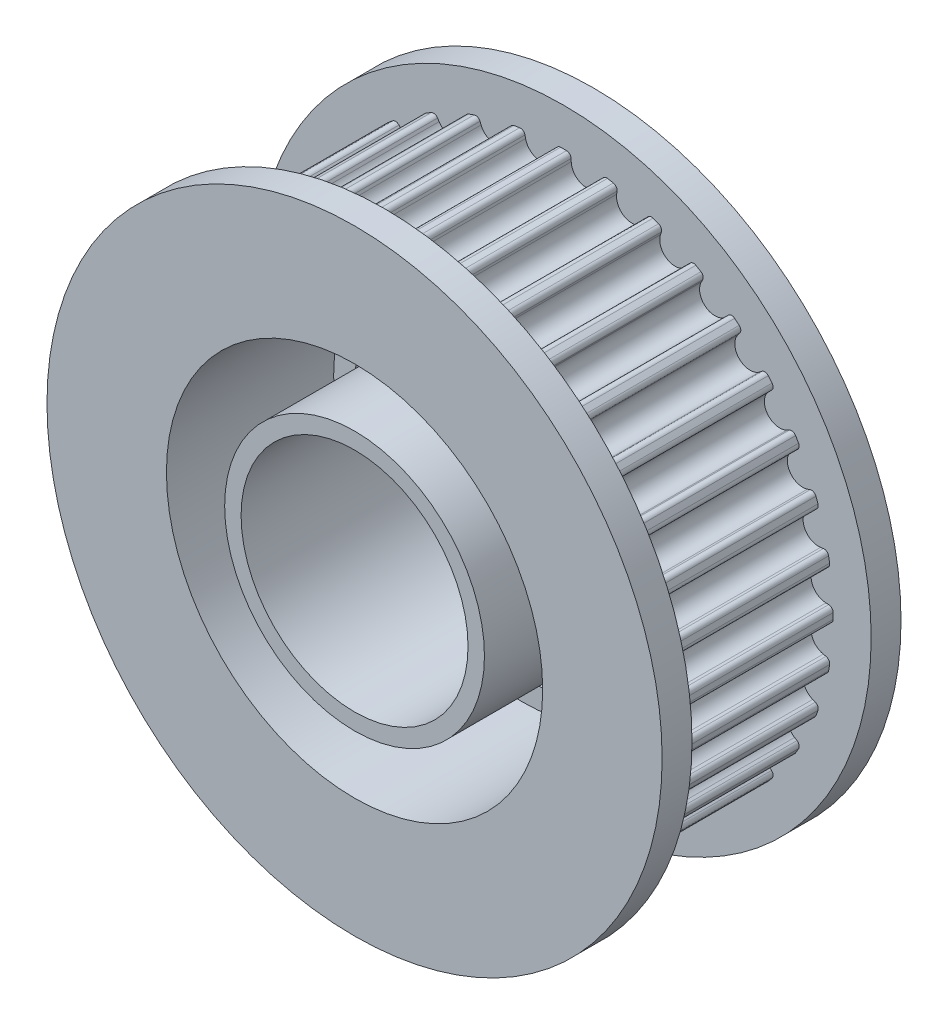
from build123d import *

# Parameters (mm, degrees)
SKETCH2_R         = 45.15
EXTRUDE1_DEPTH    = 15
EXTRUDE2_DEPTH    = 71.54817503
CIRPATTERN1_COUNT = 36
SKETCH3_R         = 51.5
EXTRUDE3_DEPTH    = 5
EXTRUDE4_START    = 5
SKETCH4_R         = 51.5
EXTRUDE4_DEPTH    = 5
SKETCH6_W         = 19
SKETCH6_H         = 40


with BuildPart() as part:
    # Sketch2 → Extrude1 (new, symmetric)
    with BuildSketch(Plane.XY):
        Circle(SKETCH2_R)
    extrude(amount=EXTRUDE1_DEPTH, both=True)

    # Sketch1 → Extrude2 (cut, through all)
    with BuildSketch(Plane.XY.offset(15)):
        with BuildLine():
            Line((-1.265610805, 44.394558923), (-1.282106289, 43.922190055))
            ThreePointArc((-1.282106289, 43.922190055), (-3.626550456, 41.451661388), (-6.364380048, 43.477548716))
            Line((-6.364380048, 43.477548716), (-6.462650922, 43.939876828))
            ThreePointArc((-6.462650922, 43.939876828), (-6.785899963, 44.421956093), (-7.352628199, 44.547293504))
            ThreePointArc((-7.352628199, 44.547293504), (-3.935081785, 44.978190619), (-0.494631081, 45.147290507))
            ThreePointArc((-0.494631081, 45.147290507), (-1.030984829, 44.925445927), (-1.265610805, 44.394558923))
        make_face()
    extrude2 = extrude(amount=-EXTRUDE2_DEPTH, mode=Mode.SUBTRACT)

    # CirPattern1: Extrude2 ×36 about axis
    cirpattern1_axis = Axis((0, 0, 0), (0, 0, 1))
    for i in range(1, CIRPATTERN1_COUNT):
        add(extrude2.rotate(cirpattern1_axis, i * 360 / CIRPATTERN1_COUNT), mode=Mode.SUBTRACT)

    # Sketch3 → Extrude3 (add)
    with BuildSketch(Plane(origin=(0, 0, -15), x_dir=(-1, 0, 0), z_dir=(0, 0, -1))):
        Circle(SKETCH3_R)
    extrude(amount=EXTRUDE3_DEPTH)

    # Sketch4 → Extrude4 (add)
    with BuildSketch(Plane.XY.offset(15).offset(EXTRUDE4_START)):
        with Locations(Location((0, 0, 0), (0, 0, 180))):
            Circle(SKETCH4_R)
    extrude(amount=-EXTRUDE4_DEPTH)

    # Sketch6 → Cut-Revolve1 (revolve, cut)
    with BuildSketch(Plane(origin=(0, 0, 0), x_dir=(1, 0, 0), z_dir=(0, 1, 0)), mode=Mode.PRIVATE) as cut_revolve1_sk:
        with Locations((9.5, 0)):
            Rectangle(SKETCH6_W, SKETCH6_H)
        Polygon((21.75, -20), (31.5, -20), (31.5, 8), (28, 8), (28, 10), (21.75, 10), align=None)
    revolve(cut_revolve1_sk.sketch.rotate(Axis((0, 0, -20), (0, 0, 1)), 180), axis=Axis((0, 0, -20), (0, 0, 1)), mode=Mode.SUBTRACT)


solid = part.part
